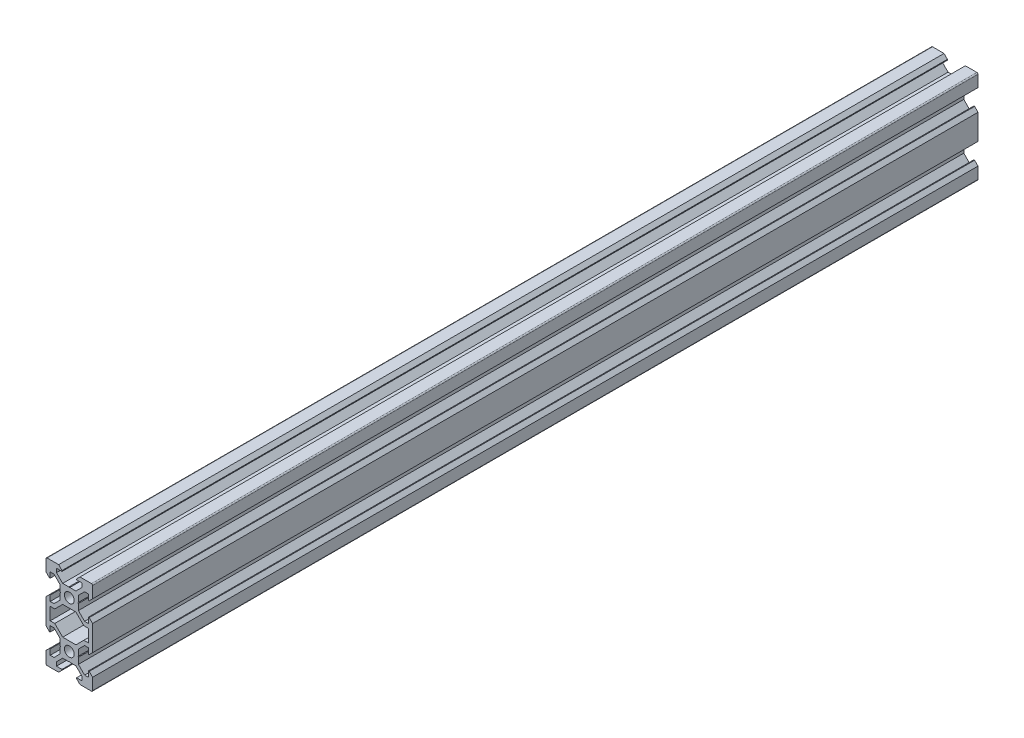
from build123d import *

# Parameters (mm, degrees)
SKETCH2_R           = 2.1
BOSS_EXTRUDE1_DEPTH = 380


with BuildPart() as part:
    # Sketch2 → Boss-Extrude1 (new body)
    with BuildSketch(Plane.XY):
        with BuildLine():
            Line((4.006804208, 10.145798499), (3.796804208, 10.355798499))
            Line((3.796804208, 10.355798499), (4.006804208, 10.565798499))
            Line((4.006804208, 10.565798499), (4.006804208, 13.195138327))
            Line((4.006804208, 13.195138327), (6.66746438, 15.855798499))
            Line((6.66746438, 15.855798499), (8.306804208, 15.855798499))
            Line((8.306804208, 15.855798499), (8.306804208, 13.480798499))
            Line((8.306804208, 13.480798499), (8.651804208, 13.480798499))
            Line((8.651804208, 13.480798499), (10.106804208, 14.935798499))
            Line((10.106804208, 14.935798499), (10.106804208, 19.855798499))
            ThreePointArc((10.106804208, 19.855798499), (9.960357598, 20.209351889), (9.606804208, 20.355798499))
            Line((9.606804208, 20.355798499), (4.686804208, 20.355798499))
            Line((4.686804208, 20.355798499), (3.231804208, 18.900798499))
            Line((3.231804208, 18.900798499), (3.231804208, 18.555798499))
            Line((3.231804208, 18.555798499), (5.606804208, 18.555798499))
            Line((5.606804208, 18.555798499), (5.606804208, 16.91645867))
            Line((5.606804208, 16.91645867), (2.946144036, 14.255798499))
            Line((2.946144036, 14.255798499), (0.316804208, 14.255798499))
            Line((0.316804208, 14.255798499), (0.106804208, 14.045798499))
            Line((0.106804208, 14.045798499), (-0.103195792, 14.255798499))
            Line((-0.103195792, 14.255798499), (-2.73253562, 14.255798499))
            Line((-2.73253562, 14.255798499), (-5.393195792, 16.91645867))
            Line((-5.393195792, 16.91645867), (-5.393195792, 18.555798499))
            Line((-5.393195792, 18.555798499), (-3.018195792, 18.555798499))
            Line((-3.018195792, 18.555798499), (-3.018195792, 18.900798499))
            Line((-3.018195792, 18.900798499), (-4.473195792, 20.355798499))
            Line((-4.473195792, 20.355798499), (-9.393195792, 20.355798499))
            ThreePointArc((-9.393195792, 20.355798499), (-9.746749183, 20.209351889), (-9.893195792, 19.855798499))
            Line((-9.893195792, 19.855798499), (-9.893195792, 14.935798499))
            Line((-9.893195792, 14.935798499), (-8.438195792, 13.480798499))
            Line((-8.438195792, 13.480798499), (-8.093195792, 13.480798499))
            Line((-8.093195792, 13.480798499), (-8.093195792, 15.855798499))
            Line((-8.093195792, 15.855798499), (-6.453855964, 15.855798499))
            Line((-6.453855964, 15.855798499), (-3.793195792, 13.195138327))
            Line((-3.793195792, 13.195138327), (-3.793195792, 10.565798499))
            Line((-3.793195792, 10.565798499), (-3.583195792, 10.355798499))
            Line((-3.583195792, 10.355798499), (-3.793195792, 10.145798499))
            Line((-3.793195792, 10.145798499), (-3.793195792, 7.51645867))
            Line((-3.793195792, 7.51645867), (-6.453855964, 4.855798499))
            Line((-6.453855964, 4.855798499), (-8.093195792, 4.855798499))
            Line((-8.093195792, 4.855798499), (-8.093195792, 7.230798499))
            Line((-8.093195792, 7.230798499), (-8.438195792, 7.230798499))
            Line((-8.438195792, 7.230798499), (-9.893195792, 5.775798499))
            Line((-9.893195792, 5.775798499), (-9.893195792, -5.064201501))
            Line((-9.893195792, -5.064201501), (-8.438195792, -6.519201501))
            Line((-8.438195792, -6.519201501), (-8.093195792, -6.519201501))
            Line((-8.093195792, -6.519201501), (-8.093195792, -4.144201501))
            Line((-8.093195792, -4.144201501), (-6.453855964, -4.144201501))
            Line((-6.453855964, -4.144201501), (-3.793195792, -6.804861673))
            Line((-3.793195792, -6.804861673), (-3.793195792, -9.434201501))
            Line((-3.793195792, -9.434201501), (-3.583195792, -9.644201501))
            Line((-3.583195792, -9.644201501), (-3.793195792, -9.854201501))
            Line((-3.793195792, -9.854201501), (-3.793195792, -12.48354133))
            Line((-3.793195792, -12.48354133), (-6.453855964, -15.144201501))
            Line((-6.453855964, -15.144201501), (-8.093195792, -15.144201501))
            Line((-8.093195792, -15.144201501), (-8.093195792, -12.769201501))
            Line((-8.093195792, -12.769201501), (-8.438195792, -12.769201501))
            Line((-8.438195792, -12.769201501), (-9.893195792, -14.224201501))
            Line((-9.893195792, -14.224201501), (-9.893195792, -19.144201501))
            ThreePointArc((-9.893195792, -19.144201501), (-9.746749183, -19.497754892), (-9.393195792, -19.644201501))
            Line((-9.393195792, -19.644201501), (-4.473195792, -19.644201501))
            Line((-4.473195792, -19.644201501), (-3.018195792, -18.189201501))
            Line((-3.018195792, -18.189201501), (-3.018195792, -17.844201501))
            Line((-3.018195792, -17.844201501), (-5.393195792, -17.844201501))
            Line((-5.393195792, -17.844201501), (-5.393195792, -16.204861673))
            Line((-5.393195792, -16.204861673), (-2.73253562, -13.544201501))
            Line((-2.73253562, -13.544201501), (-0.103195792, -13.544201501))
            Line((-0.103195792, -13.544201501), (0.106804208, -13.334201501))
            Line((0.106804208, -13.334201501), (0.316804208, -13.544201501))
            Line((0.316804208, -13.544201501), (2.946144036, -13.544201501))
            Line((2.946144036, -13.544201501), (5.606804208, -16.204861673))
            Line((5.606804208, -16.204861673), (5.606804208, -17.844201501))
            Line((5.606804208, -17.844201501), (3.231804208, -17.844201501))
            Line((3.231804208, -17.844201501), (3.231804208, -18.189201501))
            Line((3.231804208, -18.189201501), (4.686804208, -19.644201501))
            Line((4.686804208, -19.644201501), (9.606804208, -19.644201501))
            ThreePointArc((9.606804208, -19.644201501), (9.960357598, -19.497754892), (10.106804208, -19.144201501))
            Line((10.106804208, -19.144201501), (10.106804208, -14.224201501))
            Line((10.106804208, -14.224201501), (8.651804208, -12.769201501))
            Line((8.651804208, -12.769201501), (8.306804208, -12.769201501))
            Line((8.306804208, -12.769201501), (8.306804208, -15.144201501))
            Line((8.306804208, -15.144201501), (6.66746438, -15.144201501))
            Line((6.66746438, -15.144201501), (4.006804208, -12.48354133))
            Line((4.006804208, -12.48354133), (4.006804208, -9.854201501))
            Line((4.006804208, -9.854201501), (3.796804208, -9.644201501))
            Line((3.796804208, -9.644201501), (4.006804208, -9.434201501))
            Line((4.006804208, -9.434201501), (4.006804208, -6.804861673))
            Line((4.006804208, -6.804861673), (6.66746438, -4.144201501))
            Line((6.66746438, -4.144201501), (8.306804208, -4.144201501))
            Line((8.306804208, -4.144201501), (8.306804208, -6.519201501))
            Line((8.306804208, -6.519201501), (8.651804208, -6.519201501))
            Line((8.651804208, -6.519201501), (10.106804208, -5.064201501))
            Line((10.106804208, -5.064201501), (10.106804208, 5.775798499))
            Line((10.106804208, 5.775798499), (8.651804208, 7.230798499))
            Line((8.651804208, 7.230798499), (8.306804208, 7.230798499))
            Line((8.306804208, 7.230798499), (8.306804208, 4.855798499))
            Line((8.306804208, 4.855798499), (6.66746438, 4.855798499))
            Line((6.66746438, 4.855798499), (4.006804208, 7.51645867))
            Line((4.006804208, 7.51645867), (4.006804208, 10.145798499))
        make_face()
        with Locations((0.106804208, -9.644201501)):
            Circle(SKETCH2_R, mode=Mode.SUBTRACT)
        with Locations((0.106804208, 10.355798499)):
            Circle(SKETCH2_R, mode=Mode.SUBTRACT)
        Polygon((-6.13253562, -2.344201501), (-2.73253562, -5.744201501), (2.946144036, -5.744201501), (6.346144036, -2.344201501), (8.306804208, -2.344201501), (8.306804208, 3.055798499), (6.346144036, 3.055798499), (2.946144036, 6.455798499), (-2.73253562, 6.455798499), (-6.13253562, 3.055798499), (-8.093195792, 3.055798499), (-8.093195792, -2.344201501), align=None, mode=Mode.SUBTRACT)
    extrude(amount=BOSS_EXTRUDE1_DEPTH)


solid = part.part
